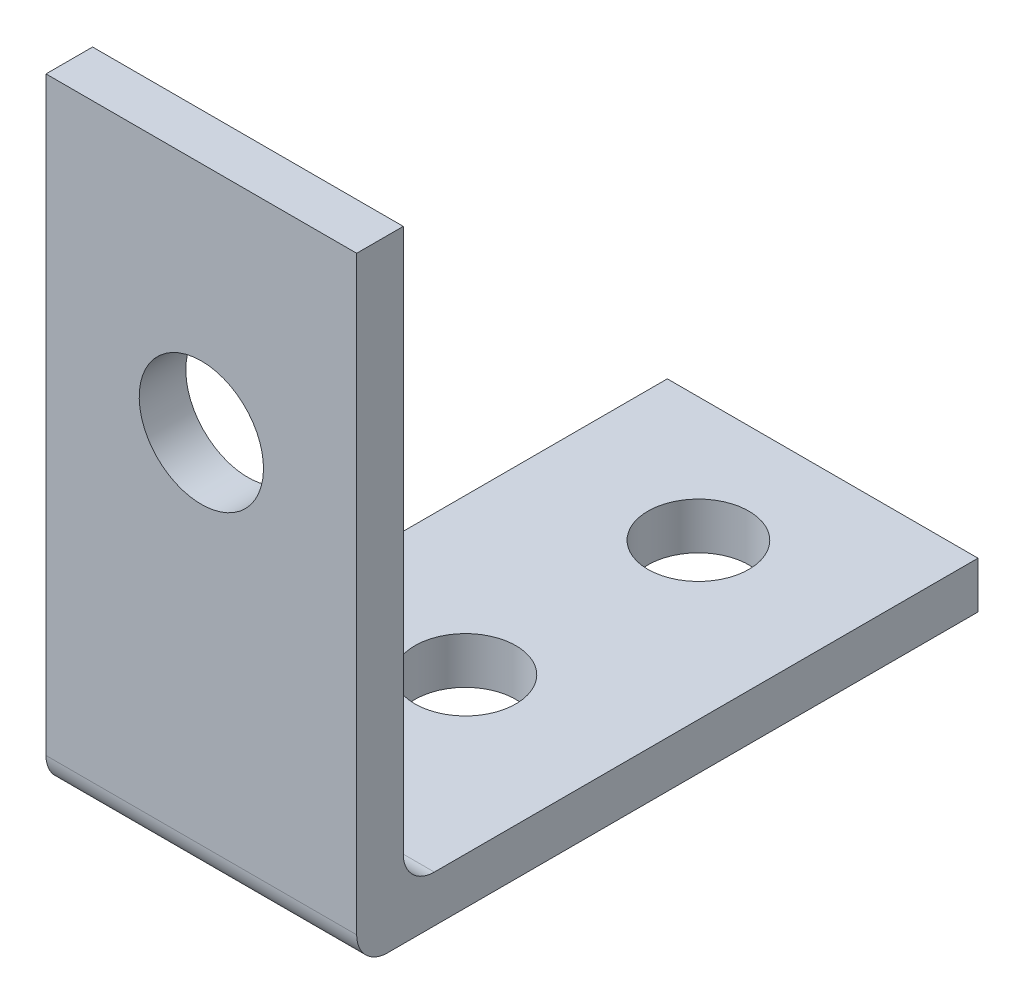
from build123d import *

# Parameters (mm, degrees)
BOSS_EXTRUDE1_DEPTH = 20
SKETCH3_R           = 4
CUT_EXTRUDE1_DEPTH  = 59.043087444
SKETCH4_R           = 3.25
CUT_EXTRUDE2_DEPTH  = 59.043087444


with BuildPart() as part:
    # Sketch1 → Boss-Extrude1 (new body)
    with BuildSketch(Plane(origin=(0, 0, 0), x_dir=(0, 0, -1), z_dir=(1, 0, 0))):
        with BuildLine():
            Line((0, 2), (0, 40))
            Line((0, 40), (3, 40))
            Line((3, 40), (3, 5))
            ThreePointArc((3, 5), (3.585786438, 3.585786438), (5, 3))
            Line((5, 3), (40, 3))
            Line((40, 3), (40, 0))
            Line((40, 0), (2, 0))
            ThreePointArc((2, 0), (0.585786438, 0.585786438), (0, 2))
        make_face()
    extrude(amount=BOSS_EXTRUDE1_DEPTH)

    # Sketch3 → Cut-Extrude1 (cut, through all)
    with BuildSketch(Plane(origin=(0, 0, -3), x_dir=(-1, 0, 0), z_dir=(0, 0, -1))):
        with Locations(Location((-10, 25, 0), (0, 0, 90))):
            Circle(SKETCH3_R)
    extrude(amount=-CUT_EXTRUDE1_DEPTH, mode=Mode.SUBTRACT)

    # Sketch4 → Cut-Extrude2 (cut, through all)
    with BuildSketch(Plane(origin=(0, 3, 0), x_dir=(1, 0, 0), z_dir=(0, 1, 0))):
        with Locations(Location((10, 32, 0), (0, 0, 270))):
            Circle(SKETCH4_R)
        with Locations(Location((10, 17, 0), (0, 0, 270))):
            Circle(SKETCH4_R)
    extrude(amount=-CUT_EXTRUDE2_DEPTH, mode=Mode.SUBTRACT)


solid = part.part
